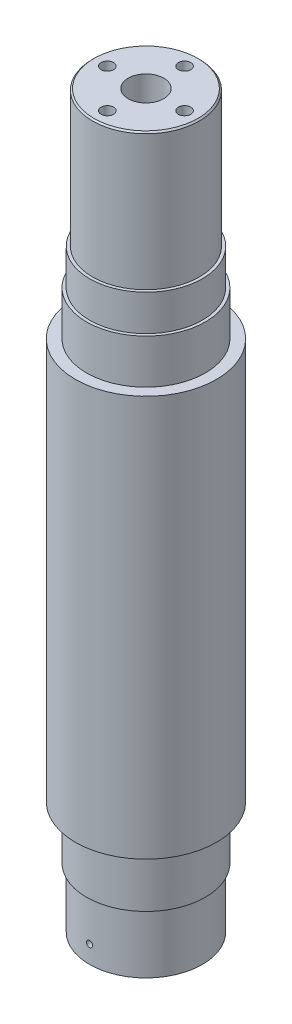
from build123d import *

# Parameters (mm, degrees)
BOSS_EXTRUDE1_DEPTH                    = 95
BOSS_EXTRUDE1_DEPTH_BACK               = 105
SKETCH1_R                              = 25
SKETCH2_R                              = 18
BOSS_EXTRUDE2_DEPTH                    = 46
CUT_EXTRUDE1_DEPTH                     = 10
CHAMFER1_SIZE                          = 0.5
SKETCH9_R                              = 10
CUT_EXTRUDE2_DEPTH                     = 30
CUT_EXTRUDE2_DRAFT                     = -8
SKETCH10_R                             = 6.5
CUT_EXTRUDE3_DEPTH                     = 50
SKETCH11_R                             = 6
CUT_EXTRUDE4_DEPTH                     = 249.527664456
CIRPATTERN1_COUNT                      = 4
CUT_EXTRUDE6_START                     = 69
SKETCH21_R                             = 25
SKETCH21_R_2                           = 20
CUT_EXTRUDE6_DEPTH                     = 27
CUT_EXTRUDE7_START                     = -105
SKETCH21_2_R                           = 25
SKETCH21_2_R_2                         = 20
CUT_EXTRUDE7_DEPTH                     = 39
CUT_EXTRUDE8_START                     = -162
SKETCH23_R                             = 25
SKETCH23_R_2                           = 23.75
CUT_EXTRUDE8_DEPTH                     = 135
SKETCH24_R                             = 20
SKETCH24_R_2                           = 19
CUT_EXTRUDE9_DEPTH                     = 20.1
M2_5X0_45_TAPPED_HOLE2_D               = 2.05
M2_5X0_45_TAPPED_HOLE2_DEPTH           = 5
M2_5X0_45_TAPPED_HOLE2_TIP             = 0.615882135
M2_5X0_45_TAPPED_HOLE2_ON_FACE_2_D     = 2.05
M2_5X0_45_TAPPED_HOLE2_ON_FACE_2_DEPTH = 5
M2_5X0_45_TAPPED_HOLE2_ON_FACE_2_TIP   = 0.615882135
CUT_EXTRUDE10_START                    = -12.1
SKETCH25_R                             = 20
SKETCH25_R_2                           = 19
CUT_EXTRUDE10_DEPTH                    = 12.1


with BuildPart() as part:
    # Sketch1 → Boss-Extrude1 (new, two sides: drawn at the far end of the back side and taken through both)
    with BuildSketch(Plane(origin=(0, 0, 0), x_dir=(1, 0, 0), z_dir=(0, 1, 0)).offset(-BOSS_EXTRUDE1_DEPTH_BACK)):
        Circle(SKETCH1_R)
    extrude(amount=BOSS_EXTRUDE1_DEPTH + BOSS_EXTRUDE1_DEPTH_BACK)

    # Sketch2 → Boss-Extrude2 (add)
    with BuildSketch(Plane(origin=(0, 95, 0), x_dir=(1, 0, 0), z_dir=(0, 1, 0))):
        Circle(SKETCH2_R)
    extrude(amount=BOSS_EXTRUDE2_DEPTH)

    # Sketch8 → Cut-Extrude1 (cut)
    with BuildSketch(Plane.XY.offset(-15)):
        with BuildLine():
            Line((3, 122), (3, 103))
            ThreePointArc((3, 103), (0, 100), (-3, 103))
            Line((-3, 103), (-3, 122))
            ThreePointArc((-3, 122), (0, 125), (3, 122))
        make_face()
    extrude(amount=-CUT_EXTRUDE1_DEPTH, mode=Mode.SUBTRACT)

    # Chamfer1
    chamfer1_edges = [part.edges().sort_by_distance(p)[0] for p in [
        (-18, 141, 0),
    ]]
    chamfer(chamfer1_edges, length=CHAMFER1_SIZE)


with BuildPart() as cut_extrude2_tool:
    # Sketch9 → Cut-Extrude2 (with draft: the straight prism first)
    with BuildSketch(Plane.XZ.offset(105)):
        Circle(SKETCH9_R)
    extrude(amount=-CUT_EXTRUDE2_DEPTH)
    # Cut-Extrude2: the draft: its side faces are tilted about the plane it starts from
    cut_extrude2_sides = [cut_extrude2_tool.faces().sort_by_distance(p)[0] for p in [
        (-10, -90, 0),
    ]]
    draft(cut_extrude2_sides, Plane.XZ.offset(105), CUT_EXTRUDE2_DRAFT)


with BuildPart() as part_1:
    add(part.part)

    # Cut-Extrude2: cut by cut_extrude2_tool
    add(cut_extrude2_tool.part, mode=Mode.SUBTRACT)

    # Sketch10 → Cut-Extrude3 (cut)
    with BuildSketch(Plane.XZ.offset(105)):
        Circle(SKETCH10_R)
    extrude(amount=-CUT_EXTRUDE3_DEPTH, mode=Mode.SUBTRACT)

    # Sketch11 → Cut-Extrude4 (cut, through all)
    with BuildSketch(Plane(origin=(0, 141, 0), x_dir=(1, 0, 0), z_dir=(0, 1, 0))):
        Circle(SKETCH11_R)
    extrude(amount=-CUT_EXTRUDE4_DEPTH, mode=Mode.SUBTRACT)

    # Sketch15 → M5x0.8 Tapped Hole1 (revolve, cut)
    with BuildSketch(Plane(origin=(0, 141, -13), x_dir=(0, 0, 1), z_dir=(1, 0, 0))):
        Polygon((0, 0), (0, 12), (2.1, 10.7381927), (2.1, 0), align=None)
    m5x0_8_tapped_hole1 = revolve(axis=Axis((0, 147.35, -13), (0, -1, 0)), mode=Mode.SUBTRACT)

    # CirPattern1: M5x0.8 Tapped Hole1 ×4 about axis
    cirpattern1_axis = Axis((0, -105, 0), (0, 1, 0))
    for i in range(1, CIRPATTERN1_COUNT):
        add(m5x0_8_tapped_hole1.rotate(cirpattern1_axis, i * 360 / CIRPATTERN1_COUNT), mode=Mode.SUBTRACT)

    # Sketch20 → M2.5x0.45 Tapped Hole1 (revolve, cut)
    with BuildSketch(Plane(origin=(12.2, -105, 0), x_dir=(0, 0, -1), z_dir=(1, 0, 0))):
        Polygon((0, 0), (0, 9.35), (1.025, 8.734117865), (1.025, 0), align=None)
    m2_5x0_45_tapped_hole1 = revolve(axis=Axis((12.2, -111.35, 0), (0, 1, 0)), mode=Mode.SUBTRACT)

    # Mirror2: M2.5x0.45 Tapped Hole1 across plane
    add(m2_5x0_45_tapped_hole1.mirror(Plane(origin=(0, 0, 0), x_dir=(0, 0, 1), z_dir=(1, 0, 0))), mode=Mode.SUBTRACT)

    # Sketch21 → Cut-Extrude6 (cut)
    with BuildSketch(Plane(origin=(0, -1, 0), x_dir=(1, 0, 0), z_dir=(0, 1, 0)).offset(CUT_EXTRUDE6_START)):
        Circle(SKETCH21_R)
        Circle(SKETCH21_R_2, mode=Mode.SUBTRACT)
    extrude(amount=CUT_EXTRUDE6_DEPTH, mode=Mode.SUBTRACT)

    # Sketch21<2> → Cut-Extrude7 (cut)
    with BuildSketch(Plane(origin=(0, -1, 0), x_dir=(1, 0, 0), z_dir=(0, 1, 0)).offset(CUT_EXTRUDE7_START)):
        Circle(SKETCH21_2_R)
        Circle(SKETCH21_2_R_2, mode=Mode.SUBTRACT)
    extrude(amount=CUT_EXTRUDE7_DEPTH, mode=Mode.SUBTRACT)

    # Sketch23 → Cut-Extrude8 (cut)
    with BuildSketch(Plane(origin=(0, 95, 0), x_dir=(1, 0, 0), z_dir=(0, 1, 0)).offset(CUT_EXTRUDE8_START)):
        Circle(SKETCH23_R)
        Circle(SKETCH23_R_2, mode=Mode.SUBTRACT)
    extrude(amount=CUT_EXTRUDE8_DEPTH, mode=Mode.SUBTRACT)

    # Sketch24 → Cut-Extrude9 (cut)
    with BuildSketch(Plane.XZ.offset(105)):
        Circle(SKETCH24_R)
        Circle(SKETCH24_R_2, mode=Mode.SUBTRACT)
    extrude(amount=-CUT_EXTRUDE9_DEPTH, mode=Mode.SUBTRACT)

    # M2.5x0.45 Tapped Hole2
    with Locations(Plane(origin=(0, -99, -19), x_dir=(-1, 0, 0), z_dir=(0, 0, -1))):
        with Locations((0, 0)):
            Hole(M2_5X0_45_TAPPED_HOLE2_D / 2, depth=M2_5X0_45_TAPPED_HOLE2_DEPTH)
            with Locations((0, 0, -(M2_5X0_45_TAPPED_HOLE2_DEPTH + M2_5X0_45_TAPPED_HOLE2_TIP / 2))):  # 118° drill point
                Cone(0, M2_5X0_45_TAPPED_HOLE2_D / 2, M2_5X0_45_TAPPED_HOLE2_TIP, mode=Mode.SUBTRACT)

    # M2.5x0.45 Tapped Hole2 on face 2
    with Locations(Plane(origin=(0, -99, 19), x_dir=(1, 0, 0), z_dir=(0, 0, 1))):
        with Locations((0, 0)):
            Hole(M2_5X0_45_TAPPED_HOLE2_ON_FACE_2_D / 2, depth=M2_5X0_45_TAPPED_HOLE2_ON_FACE_2_DEPTH)
            with Locations((0, 0, -(M2_5X0_45_TAPPED_HOLE2_ON_FACE_2_DEPTH + M2_5X0_45_TAPPED_HOLE2_ON_FACE_2_TIP / 2))):  # 118° drill point
                Cone(0, M2_5X0_45_TAPPED_HOLE2_ON_FACE_2_D / 2, M2_5X0_45_TAPPED_HOLE2_ON_FACE_2_TIP, mode=Mode.SUBTRACT)

    # Sketch25 → Cut-Extrude10 (cut)
    with BuildSketch(Plane(origin=(0, 95, 0), x_dir=(1, 0, 0), z_dir=(0, 1, 0)).offset(CUT_EXTRUDE10_START)):
        Circle(SKETCH25_R)
        Circle(SKETCH25_R_2, mode=Mode.SUBTRACT)
    extrude(amount=CUT_EXTRUDE10_DEPTH, mode=Mode.SUBTRACT)


solid = part_1.part
